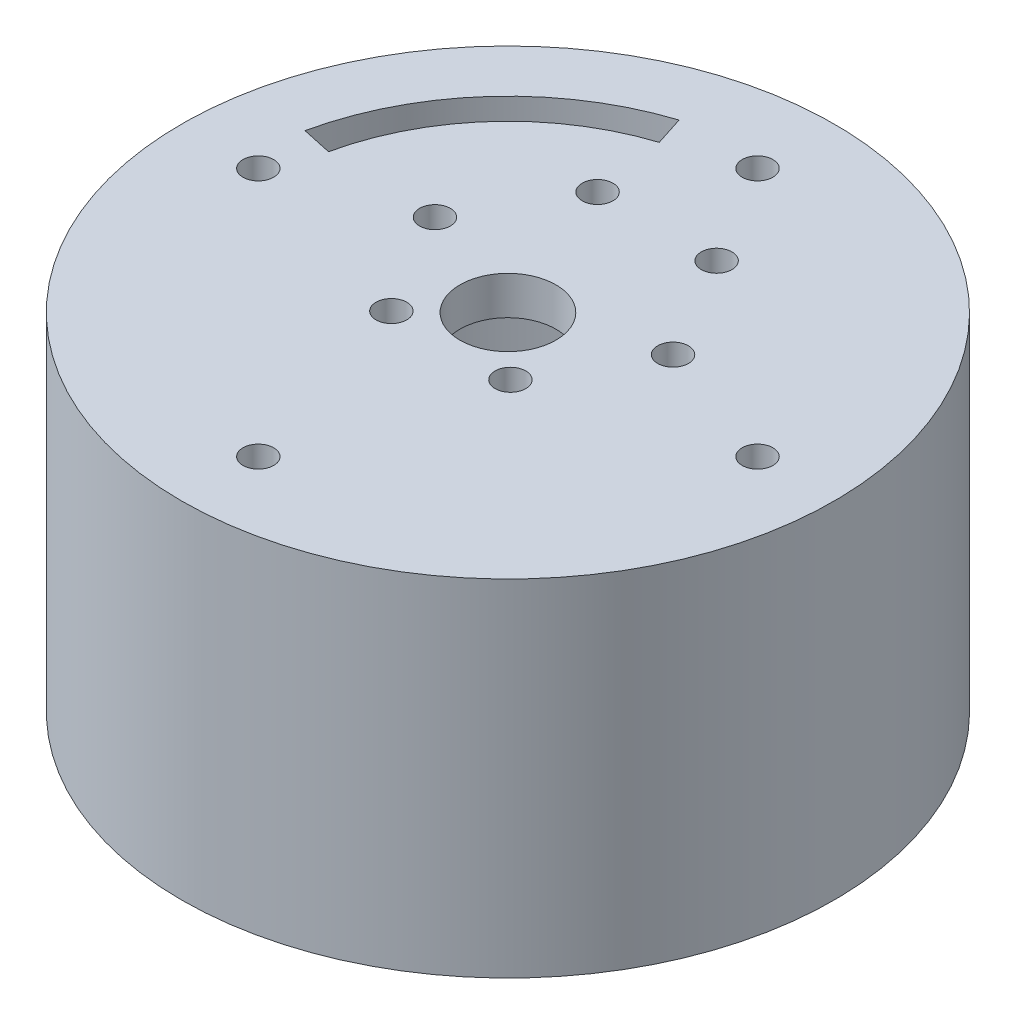
from build123d import *

# Parameters (mm, degrees)
IZIM6_R                     = 42.5
IZIM6_R_2                   = 38
Y_KSEKLIK_EKSTR_ZYON1_DEPTH = 40
IZIM7_R                     = 42.5
Y_KSEKLIK_EKSTR_ZYON2_DEPTH = 5
IZIM8_R                     = 2
IZIM8_R_2                   = 6.25
KES_EKSTR_ZYON2_DEPTH       = 5
KES_EKSTR_ZYON4_DEPTH       = 5


with BuildPart() as part:
    # Çizim6 → Yükseklik-Ekstrüzyon1 (new body)
    with BuildSketch(Plane(origin=(0, 0, 0), x_dir=(1, 0, 0), z_dir=(0, 1, 0))):
        with Locations(Location((0, 0, 0), (0, 0, 270))):
            Circle(IZIM6_R)
        with Locations(Location((0, 0, 0), (0, 0, 270))):
            Circle(IZIM6_R_2, mode=Mode.SUBTRACT)
    extrude(amount=Y_KSEKLIK_EKSTR_ZYON1_DEPTH)

    # Çizim7 → Yükseklik-Ekstrüzyon2 (add)
    with BuildSketch(Plane(origin=(0, 40, 0), x_dir=(1, 0, 0), z_dir=(0, 1, 0))):
        with Locations(Location((0, 0, 0), (0, 0, 270))):
            Circle(IZIM7_R)
    extrude(amount=Y_KSEKLIK_EKSTR_ZYON2_DEPTH)

    # Çizim8 → Kes-Ekstrüzyon2 (cut)
    with BuildSketch(Plane(origin=(0, 45, 0), x_dir=(1, 0, 0), z_dir=(0, 1, 0))):
        with Locations(Location((0, 32.5, 0), (0, 0, 270))):
            Circle(IZIM8_R)
        with Locations(Location((-32.5, 0, 0), (0, 0, 270))):
            Circle(IZIM8_R)
        with Locations(Location((32.5, 0, 0), (0, 0, 270))):
            Circle(IZIM8_R)
        with Locations(Location((0, -32.5, 0), (0, 0, 270))):
            Circle(IZIM8_R)
        with Locations(Location((0, 0, 0), (0, 0, 270))):
            Circle(IZIM8_R_2)
        with Locations(Location((-15.5, 6, 0), (0, 0, 270))):
            Circle(IZIM8_R)
        with Locations(Location((-7.75, 19.423393759, 0), (0, 0, 270))):
            Circle(IZIM8_R)
        with Locations(Location((7.75, 19.423393759, 0), (0, 0, 270))):
            Circle(IZIM8_R)
        with Locations(Location((15.5, 6, 0), (0, 0, 270))):
            Circle(IZIM8_R)
        with Locations(Location((7.75, -7.423393759, 0), (0, 0, 270))):
            Circle(IZIM8_R)
        with Locations(Location((-7.75, -7.423393759, 0), (0, 0, 270))):
            Circle(IZIM8_R)
    extrude(amount=-KES_EKSTR_ZYON2_DEPTH, mode=Mode.SUBTRACT)

    # Çizim11 → Kes-Ekstrüzyon4 (cut)
    with BuildSketch(Plane(origin=(0, 45, 0), x_dir=(1, 0, 0), z_dir=(0, 1, 0))):
        with BuildLine():
            Line((-33.71988341, 7.295167084), (-29.810331711, 6.44935061))
            ThreePointArc((-29.810331711, 6.44935061), (-22.597803721, 20.483878221), (-9.336800782, 29.035739205))
            Line((-9.336800782, 29.035739205), (-10.561299245, 32.843705002))
            ThreePointArc((-10.561299245, 32.843705002), (-25.561450111, 23.170288479), (-33.71988341, 7.295167084))
        make_face()
    extrude(amount=-KES_EKSTR_ZYON4_DEPTH, mode=Mode.SUBTRACT)


solid = part.part
